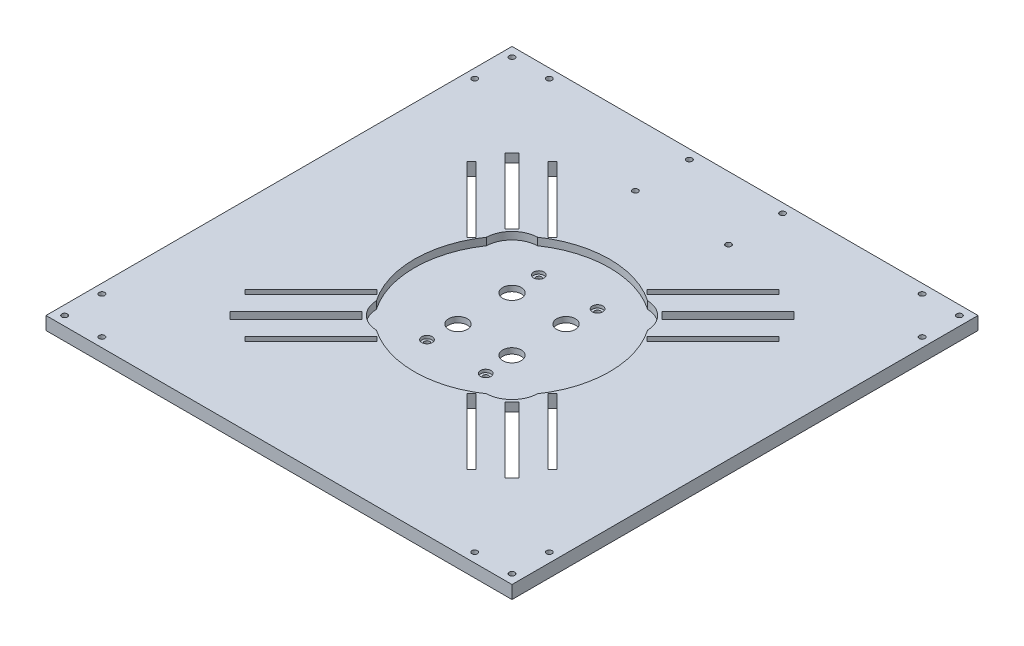
from build123d import *

# Parameters (mm, degrees)
SKETCH1_W               = 250
SKETCH1_H               = 250
BOSS_EXTRUDE1_DEPTH     = 7
CUT_EXTRUDE2_DEPTH      = 4
CUT_EXTRUDE3_DEPTH      = 177.91523394
CUT_EXTRUDE4_DEPTH      = 177.91523394
CUT_EXTRUDE5_DEPTH      = 2.3
CIRPATTERN1_COUNT       = 4
SKETCH8_R               = 5
CUT_EXTRUDE6_DEPTH      = 177.91523394
SKETCH9_R               = 1.5
CUT_EXTRUDE7_DEPTH      = 177.821944339
SKETCH10_R              = 2.8
CUT_EXTRUDE8_DEPTH      = 1.6
SKETCH13_R              = 1.5
CUT_EXTRUDE11_DEPTH     = 177.91523394
LPATTERN1_COUNT         = 2
LPATTERN1_PITCH         = 50
LPATTERN1_COUNT_DIR2    = 2
LPATTERN1_PITCH_DIR2    = 29
SKETCH14_R              = 1.5
CUT_EXTRUDE12_DEPTH     = 10
MIRROR3_COPY_1_SKETCH_R = 1.5
MIRROR3_COPY_1_DEPTH    = 10


with BuildPart() as part:
    # Sketch1 → Boss-Extrude1 (new body)
    with BuildSketch(Plane(origin=(0, 0, 0), x_dir=(1, 0, 0), z_dir=(0, 1, 0))):
        Rectangle(SKETCH1_W, SKETCH1_H)
    extrude(amount=BOSS_EXTRUDE1_DEPTH)

    # Sketch4 → Cut-Extrude2 (cut)
    with BuildSketch(Plane(origin=(0, 7, 0), x_dir=(1, 0, 0), z_dir=(0, 1, 0))):
        with BuildLine():
            ThreePointArc((-29.508381723, 43.240928622), (-39.076271632, 39.076271632), (-43.240928622, 29.508381723))
            ThreePointArc((-43.240928622, 29.508381723), (-52.35, 0), (-43.240928622, -29.508381723))
            ThreePointArc((-43.240928622, -29.508381723), (-39.076271632, -39.076271632), (-29.508381723, -43.240928622))
            ThreePointArc((-29.508381723, -43.240928622), (0, -52.35), (29.508381723, -43.240928622))
            ThreePointArc((29.508381723, -43.240928622), (39.076271632, -39.076271632), (43.240928622, -29.508381723))
            ThreePointArc((43.240928622, -29.508381723), (52.35, 0), (43.240928622, 29.508381723))
            ThreePointArc((43.240928622, 29.508381723), (39.076271632, 39.076271632), (29.508381723, 43.240928622))
            ThreePointArc((29.508381723, 43.240928622), (0, 52.35), (-29.508381723, 43.240928622))
        make_face()
    extrude(amount=-CUT_EXTRUDE2_DEPTH, mode=Mode.SUBTRACT)

    # Sketch5 → Cut-Extrude3 (cut, through all)
    with BuildSketch(Plane(origin=(0, 7, 0), x_dir=(1, 0, 0), z_dir=(0, 1, 0))):
        Polygon((-40.2277855, 40.2277855), (-38.35395253, 42.10161847), (-73.709291589, 77.456957529), (-77.456957529, 73.709291589), (-42.10161847, 38.35395253), align=None)
    cut_extrude3 = extrude(amount=-CUT_EXTRUDE3_DEPTH, mode=Mode.SUBTRACT)

    # Sketch6 → Cut-Extrude4 (cut, through all)
    with BuildSketch(Plane(origin=(0, 7, 0), x_dir=(1, 0, 0), z_dir=(0, 1, 0))):
        Polygon((-26.542386103, 45.987822586), (-61.897725163, 81.343161645), (-59.493562107, 83.747324701), (-24.138223047, 48.391985642), align=None)
        Polygon((-81.343161645, 61.897725163), (-83.747324701, 59.493562107), (-48.391985642, 24.138223047), (-45.987822586, 26.542386103), align=None)
    cut_extrude4 = extrude(amount=-CUT_EXTRUDE4_DEPTH, mode=Mode.SUBTRACT)

    # Sketch7 → Cut-Extrude5 (cut)
    with BuildSketch(Plane.XZ):
        Polygon((-90.835333565, -74.571877598), (-41.337858882, -25.074402915), (-25.074402915, -41.337858882), (-74.571877598, -90.835333565), align=None)
    cut_extrude5 = extrude(amount=-CUT_EXTRUDE5_DEPTH, mode=Mode.SUBTRACT)

    # CirPattern1: Cut-Extrude3, Cut-Extrude4, Cut-Extrude5 ×4 about axis
    cirpattern1_axis = Axis((0, 0, 0), (0, 1, 0))
    add([cut_extrude3.rotate(cirpattern1_axis, i * 360 / CIRPATTERN1_COUNT) for i in range(1, CIRPATTERN1_COUNT)], mode=Mode.SUBTRACT)
    add([cut_extrude4.rotate(cirpattern1_axis, i * 360 / CIRPATTERN1_COUNT) for i in range(1, CIRPATTERN1_COUNT)], mode=Mode.SUBTRACT)
    add([cut_extrude5.rotate(cirpattern1_axis, i * 360 / CIRPATTERN1_COUNT) for i in range(1, CIRPATTERN1_COUNT)], mode=Mode.SUBTRACT)

    # Sketch8 → Cut-Extrude6 (cut, through all)
    with BuildSketch(Plane(origin=(0, 7, 0), x_dir=(1, 0, 0), z_dir=(0, 1, 0))):
        with Locations(Location((14.5, 14.5, 0), (0, 0, 270))):
            Circle(SKETCH8_R)
        with Locations(Location((-14.5, 14.5, 0), (0, 0, 270))):
            Circle(SKETCH8_R)
        with Locations(Location((-14.5, -14.5, 0), (0, 0, 270))):
            Circle(SKETCH8_R)
        with Locations(Location((14.5, -14.5, 0), (0, 0, 270))):
            Circle(SKETCH8_R)
    extrude(amount=-CUT_EXTRUDE6_DEPTH, mode=Mode.SUBTRACT)

    # Sketch9 → Cut-Extrude7 (cut, through all)
    with BuildSketch(Plane(origin=(0, 3, 0), x_dir=(1, 0, 0), z_dir=(0, 1, 0))):
        with Locations(Location((-15.6, -30, 0), (0, 0, 270))):
            Circle(SKETCH9_R)
        with Locations(Location((15.9, -30, 0), (0, 0, 90))):
            Circle(SKETCH9_R)
    cut_extrude7 = extrude(amount=-CUT_EXTRUDE7_DEPTH, mode=Mode.SUBTRACT)

    # Sketch10 → Cut-Extrude8 (cut)
    with BuildSketch(Plane(origin=(0, 3, 0), x_dir=(1, 0, 0), z_dir=(0, 1, 0))):
        with Locations(Location((-15.6, -30, 0), (0, 0, 270))):
            Circle(SKETCH10_R)
        with Locations(Location((15.9, -30, 0), (0, 0, 270))):
            Circle(SKETCH10_R)
    cut_extrude8 = extrude(amount=-CUT_EXTRUDE8_DEPTH, mode=Mode.SUBTRACT)

    # Sketch13 → Cut-Extrude11 (cut, through all)
    with BuildSketch(Plane(origin=(0, 7, 0), x_dir=(1, 0, 0), z_dir=(0, 1, 0))):
        with Locations(Location((25.15, 120, 0), (0, 0, 270))):
            Circle(SKETCH13_R)
    cut_extrude11 = extrude(amount=-CUT_EXTRUDE11_DEPTH, mode=Mode.SUBTRACT)

    # LPattern1: Cut-Extrude11 2 × 2
    with Locations(*[(-i * LPATTERN1_PITCH, 0, j * LPATTERN1_PITCH_DIR2) for i in range(LPATTERN1_COUNT) for j in range(LPATTERN1_COUNT_DIR2) if (i, j) != (0, 0)]):
        add(cut_extrude11, mode=Mode.SUBTRACT)

    # Mirror1: Cut-Extrude7, Cut-Extrude8 across plane
    add(cut_extrude7.mirror(Plane.XY), mode=Mode.SUBTRACT)
    add(cut_extrude8.mirror(Plane.XY), mode=Mode.SUBTRACT)

    # Sketch14 → Cut-Extrude12 (cut)
    with BuildSketch(Plane(origin=(0, 7, 0), x_dir=(1, 0, 0), z_dir=(0, 1, 0))):
        with Locations(Location((120, -100, 0), (0, 0, 270))):
            Circle(SKETCH14_R)
        with Locations(Location((120, -120, 0), (0, 0, 270))):
            Circle(SKETCH14_R)
        with Locations(Location((100, -120, 0), (0, 0, 270))):
            Circle(SKETCH14_R)
    cut_extrude12 = extrude(amount=-CUT_EXTRUDE12_DEPTH, mode=Mode.SUBTRACT)

    # Mirror2: Cut-Extrude12 across plane
    add(cut_extrude12.mirror(Plane(origin=(0, 0, 0), x_dir=(0, 0, 1), z_dir=(1, 0, 0))), mode=Mode.SUBTRACT)

    # Mirror3: Cut-Extrude12 across plane
    add(cut_extrude12.mirror(Plane.XY), mode=Mode.SUBTRACT)

    # Mirror3 copy 1 sketch → Mirror3 copy 1 (cut)
    with BuildSketch(Plane(origin=(0, 7, 0), x_dir=(-1, 0, 0), z_dir=(0, 1, 0))):
        with Locations(Location((120, -100, 0), (0, 0, 270))):
            Circle(MIRROR3_COPY_1_SKETCH_R)
        with Locations(Location((120, -120, 0), (0, 0, 270))):
            Circle(MIRROR3_COPY_1_SKETCH_R)
        with Locations(Location((100, -120, 0), (0, 0, 270))):
            Circle(MIRROR3_COPY_1_SKETCH_R)
    extrude(amount=-MIRROR3_COPY_1_DEPTH, mode=Mode.SUBTRACT)


solid = part.part
